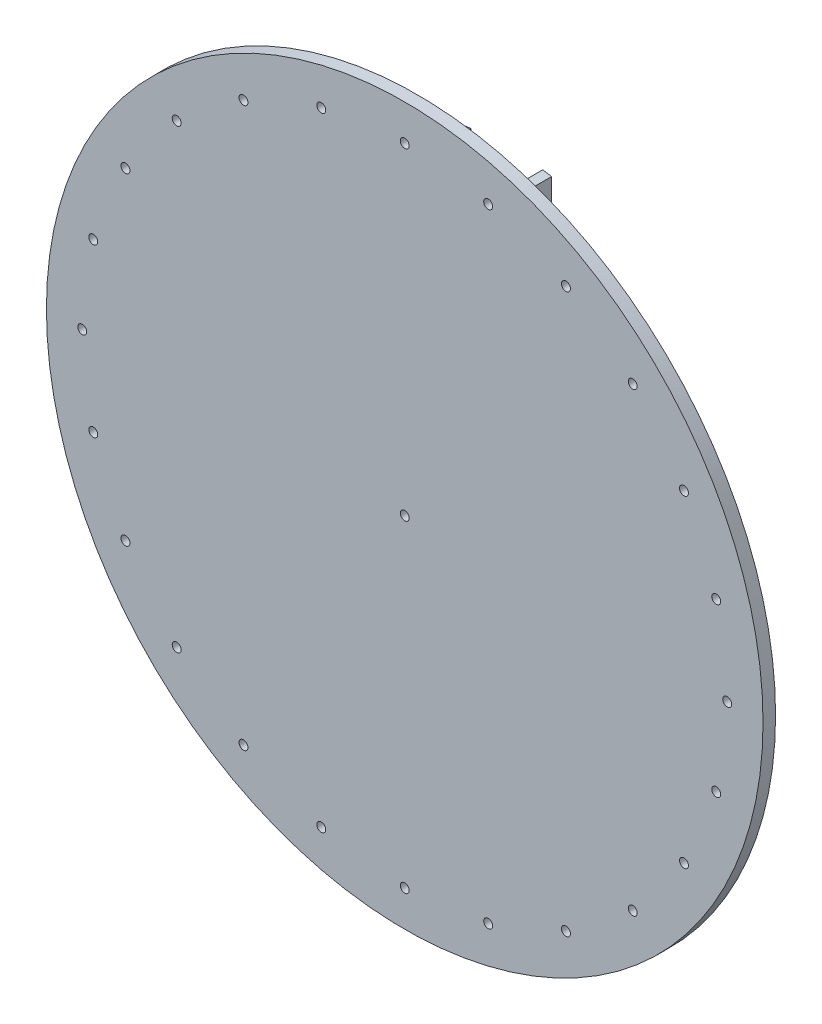
from build123d import *

# Parameters (mm, degrees)
BOSS_EXTRUDE2_DEPTH   = 50
BOSS_EXTRUDE2_2_DEPTH = 50
BOSS_EXTRUDE2_3_DEPTH = 50
SKETCH3_R             = 200
BOSS_EXTRUDE3_DEPTH   = 7
SKETCH4_R             = 2.5
CUT_EXTRUDE1_DEPTH    = 170
CIRPATTERN1_COUNT     = 3
SKETCH5_R             = 2.5
CUT_EXTRUDE2_DEPTH    = 170
CIRPATTERN2_COUNT     = 24


with BuildPart() as part:
    # Sketch2 → Boss-Extrude2 (new body)
    with BuildSketch(Plane.XY):
        with BuildLine():
            Line((0, -23.094010768), (118.743931896, -91.650851812))
            ThreePointArc((118.743931896, -91.650851812), (117.182059436, -93.639547982), (115.586884574, -95.601632383))
            Line((115.586884574, -95.601632383), (0, -28.867513459))
            Line((0, -28.867513459), (-115.586884574, -95.601632383))
            ThreePointArc((-115.586884574, -95.601632383), (-117.182059436, -93.639547982), (-118.743931896, -91.650851812))
            Line((-118.743931896, -91.650851812), (0, -23.094010768))
        make_face()
    extrude(amount=BOSS_EXTRUDE2_DEPTH)



with BuildPart() as body_2:
    # Sketch2 → Boss-Extrude2 2 (new body)
    with BuildSketch(Plane.XY):
        with BuildLine():
            Line((20, 11.547005384), (138.743931896, -57.009835661))
            ThreePointArc((138.743931896, -57.009835661), (139.68525707, -54.662866348), (140.586884574, -52.300362194))
            Line((140.586884574, -52.300362194), (25, 14.43375673))
            Line((25, 14.43375673), (25, 147.901994577))
            ThreePointArc((25, 147.901994577), (22.503197633, 148.302414331), (20, 148.660687473))
            Line((20, 148.660687473), (20, 11.547005384))
        make_face()
    extrude(amount=BOSS_EXTRUDE2_2_DEPTH)


with BuildPart() as body_3:
    # Sketch2 → Boss-Extrude2 3 (new body)
    with BuildSketch(Plane.XY):
        with BuildLine():
            Line((-20, 11.547005384), (-20, 148.660687473))
            ThreePointArc((-20, 148.660687473), (-22.503197633, 148.302414331), (-25, 147.901994577))
            Line((-25, 147.901994577), (-25, 14.43375673))
            Line((-25, 14.43375673), (-140.586884574, -52.300362194))
            ThreePointArc((-140.586884574, -52.300362194), (-139.68525707, -54.662866348), (-138.743931896, -57.009835661))
            Line((-138.743931896, -57.009835661), (-20, 11.547005384))
        make_face()
    extrude(amount=BOSS_EXTRUDE2_3_DEPTH)


with BuildPart() as part_1:
    add(part.part)

    add(body_2.part)  # Boss-Extrude3 merges body 2

    add(body_3.part)  # Boss-Extrude3 merges body 3
    # Sketch3 → Boss-Extrude3 (add)
    with BuildSketch(Plane.XY.offset(50)):
        Circle(SKETCH3_R)
    extrude(amount=BOSS_EXTRUDE3_DEPTH)

    # Sketch4 → Cut-Extrude1 (cut, symmetric)
    with BuildSketch(Plane(origin=(0, 0, 0), x_dir=(0, 0, -1), z_dir=(1, 0, 0))):
        with Locations(Location((-25, 40, 0), (0, 0, 270))):
            Circle(SKETCH4_R)
        with Locations(Location((-25, 70, 0), (0, 0, 270))):
            Circle(SKETCH4_R)
        with Locations(Location((-25, 100, 0), (0, 0, 270))):
            Circle(SKETCH4_R)
        with Locations(Location((-25, 130, 0), (0, 0, 270))):
            Circle(SKETCH4_R)
    cut_extrude1 = extrude(amount=CUT_EXTRUDE1_DEPTH, both=True, mode=Mode.SUBTRACT)

    # CirPattern1: Cut-Extrude1 ×3 about axis
    cirpattern1_axis = Axis((0, 0, 50), (0, 0, 1))
    for i in range(1, CIRPATTERN1_COUNT):
        add(cut_extrude1.rotate(cirpattern1_axis, i * 360 / CIRPATTERN1_COUNT), mode=Mode.SUBTRACT)

    # Sketch5 → Cut-Extrude2 (cut)
    with BuildSketch(Plane.XY.offset(57)):
        Circle(SKETCH5_R)
        with Locations((180, 0)):
            Circle(SKETCH5_R)
    cut_extrude2 = extrude(amount=-CUT_EXTRUDE2_DEPTH, mode=Mode.SUBTRACT)

    # CirPattern2: Cut-Extrude2 ×24 about axis
    cirpattern2_axis = Axis((0, 0, 0), (0, 0, 1))
    for i in range(1, CIRPATTERN2_COUNT):
        add(cut_extrude2.rotate(cirpattern2_axis, i * 360 / CIRPATTERN2_COUNT), mode=Mode.SUBTRACT)


solid = part_1.part
